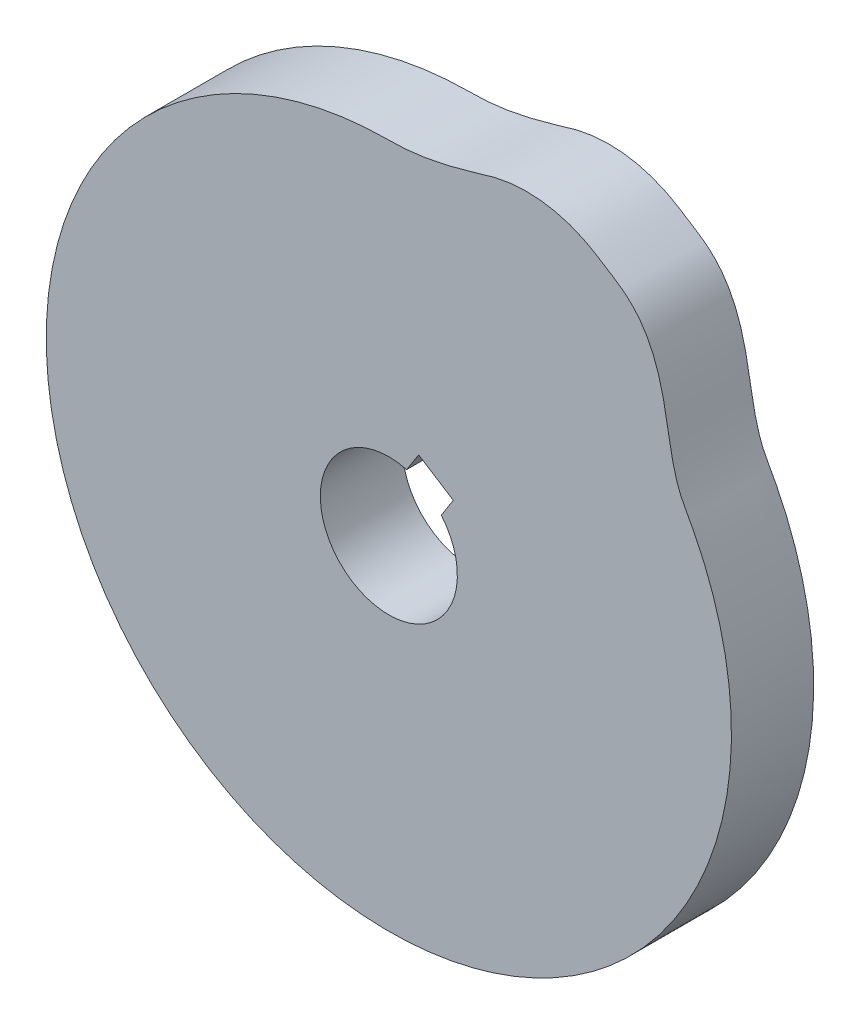
from build123d import *

# Parameters (mm, degrees)
EXTRUDE_1_DEPTH          = 12
CUT_EXTRUDE_1_DEPTH      = 12
CUT_EXTRUDE_1_DEPTH_BACK = 12


with BuildPart() as part:
    # 草图1 → 凸台-拉伸1 (new body)
    with BuildSketch(Plane.XY):
        with BuildLine():
            add(Edge.make_bspline(
                [(30.607622231, 50.43980037), (31.341297592, 49.994595232), (32.065086259, 49.533490997), (32.778643748, 49.056707126), (32.91037295, 48.968688487), (33.173122299, 48.791590035), (33.565122105, 48.522756304), (33.824984046, 48.34144758), (33.954547772, 48.250271353), (34.060023194, 48.17604648), (34.270487271, 48.026905024), (34.569445018, 47.779817794), (34.76617148, 47.612925141), (34.863181305, 47.527934022), (35.05482545, 47.360032985), (35.494955913, 46.94926467), (36.142187001, 46.250261715), (36.792641367, 45.42377913), (37.384862281, 44.541363693), (37.91949768, 43.609225479), (38.398141631, 42.634053292), (38.823318429, 41.622896009), (39.198436964, 40.583030345), (39.527736958, 39.521831251), (39.816220875, 38.44664062), (40.069572636, 37.364637195), (40.294062943, 36.282709734), (40.49644228, 35.20733637), (40.683823287, 34.144473074), (40.863554818, 33.099454173), (41.043090244, 32.076907835), (41.229852746, 31.080689518), (41.431098906, 30.113836174), (41.653783742, 29.178544438), (41.90441699, 28.276171288), (42.099742445, 27.679664642), (42.206263674, 27.382517866), (42.210135251, 27.371752191), (42.413355788, 26.806657784), (42.879813387, 25.698052247), (43.7999379, 24.138098496), (44.360678953, 23.075762027), (44.63139222, 22.53971669), (72.119376076, -31.889848937), (27.815547661, -73.786598913), (-24.995238864, -43.304018683), (-77.806025389, -12.821438453), (-63.687333874, 46.498283569), (-2.806706616, 49.921161825), (-2.205001834, 49.954991342), (-1.000369018, 50.000893151), (0.80943442, 49.992807499), (2.013334682, 50.059975256), (2.613893467, 50.110197038), (2.618001805, 50.110540598), (2.917124605, 50.135611857), (3.513859605, 50.193925478), (4.405920818, 50.304671089), (5.307030537, 50.439378989), (6.218981664, 50.597664571), (7.143557441, 50.779074136), (8.082527544, 50.98309139), (9.037651927, 51.209118724), (10.010654815, 51.456552382), (11.003313747, 51.724495602), (12.017103653, 52.012871655), (13.054565012, 52.318113444), (14.107130459, 52.647743042), (15.175485372, 52.956264141), (16.256364217, 53.19820843), (17.337295663, 53.382596806), (18.416721346, 53.506867962), (19.492006487, 53.57213127), (20.56082078, 53.578624498), (21.62077633, 53.526913209), (22.669526144, 53.417572855), (23.704740808, 53.251272173), (24.724117334, 53.028750115), (25.725379697, 52.75082144), (26.706280701, 52.418372693), (27.582231656, 52.065547722), (28.126309495, 51.814769854), (28.355445659, 51.703304493), (28.479633645, 51.642892124), (28.72664365, 51.519259405), (29.094582825, 51.32798913), (29.334391622, 51.190941977), (29.454053954, 51.121998256), (29.58308084, 51.047659126), (29.840571738, 50.898003913), (30.225122055, 50.670588321), (30.480317146, 50.517050992), (30.607622231, 50.43980037)],
                knots=[0, 0, 0, 0, 0.009956487, 0.009956487, 0.009956487, 0.011794837, 0.013633187, 0.015471537, 0.015471537, 0.015471537, 0.016968103, 0.018464669, 0.019961236, 0.019961236, 0.019961236, 0.022917722, 0.026943406, 0.031006062, 0.035112914, 0.039267464, 0.043469229, 0.047713755, 0.051992889, 0.056295224, 0.060606704, 0.064911331, 0.06919195, 0.073431088, 0.077611834, 0.08171874, 0.085738727, 0.089661987, 0.093482825, 0.097200418, 0.100819384, 0.104350073, 0.104482849, 0.104482849, 0.104482849, 0.111452307, 0.118421766, 0.125391224, 0.125391224, 0.125391224, 0.496110575, 0.496110575, 0.496110575, 0.866829926, 0.866829926, 0.866829926, 0.873824105, 0.880818284, 0.887812463, 0.887812463, 0.887812463, 0.887860309, 0.891296138, 0.894770314, 0.898291884, 0.901869565, 0.905511708, 0.909226269, 0.913020796, 0.916902422, 0.920877864, 0.924953436, 0.929135061, 0.933428288, 0.937754951, 0.942036394, 0.946275717, 0.950476046, 0.95464053, 0.958772345, 0.962874686, 0.966950771, 0.971003837, 0.975037139, 0.979053946, 0.983057541, 0.987051218, 0.990008139, 0.990008139, 0.990008139, 0.991610741, 0.993213343, 0.994815944, 0.994815944, 0.994815944, 0.996543963, 0.998271981, 1, 1, 1, 1], degree=3, weights=[1, 0.999841351, 0.999841351, 1, 1, 1, 1, 1, 1, 1, 1, 1, 1, 1, 1, 1, 1, 1, 1, 1, 1, 1, 1, 1, 1, 1, 1, 1, 1, 1, 1, 1, 1, 1, 1, 1, 1, 1, 1, 1, 1, 1, 1, 0.523857144, 0.523857144, 1, 0.523857144, 0.523857144, 1, 1, 1, 1, 1, 1, 1, 1, 1, 1, 1, 1, 1, 1, 1, 1, 1, 1, 1, 1, 1, 1, 1, 1, 1, 1, 1, 1, 1, 1, 1, 1, 1, 1, 1, 1, 1, 1, 1, 1, 1, 1, 1, 1, 1]))
        make_face()
    extrude(amount=EXTRUDE_1_DEPTH)

    # 草图2 → 切除-拉伸1 (cut, two sides: drawn at the far end of the back side and taken through both)
    with BuildSketch(Plane.XY.offset(-CUT_EXTRUDE_1_DEPTH_BACK)):
        with BuildLine():
            Line((2.595337256, 9.657340448), (4.347260624, 12.407309291))
            Line((4.347260624, 12.407309291), (9.407609299, 9.183511641))
            Line((9.407609299, 9.183511641), (7.655685931, 6.433542798))
            ThreePointArc((7.655685931, 6.433542798), (-5.372996083, -8.433914458), (2.595337256, 9.657340448))
        make_face()
    extrude(amount=CUT_EXTRUDE_1_DEPTH + CUT_EXTRUDE_1_DEPTH_BACK, mode=Mode.SUBTRACT)


solid = part.part
